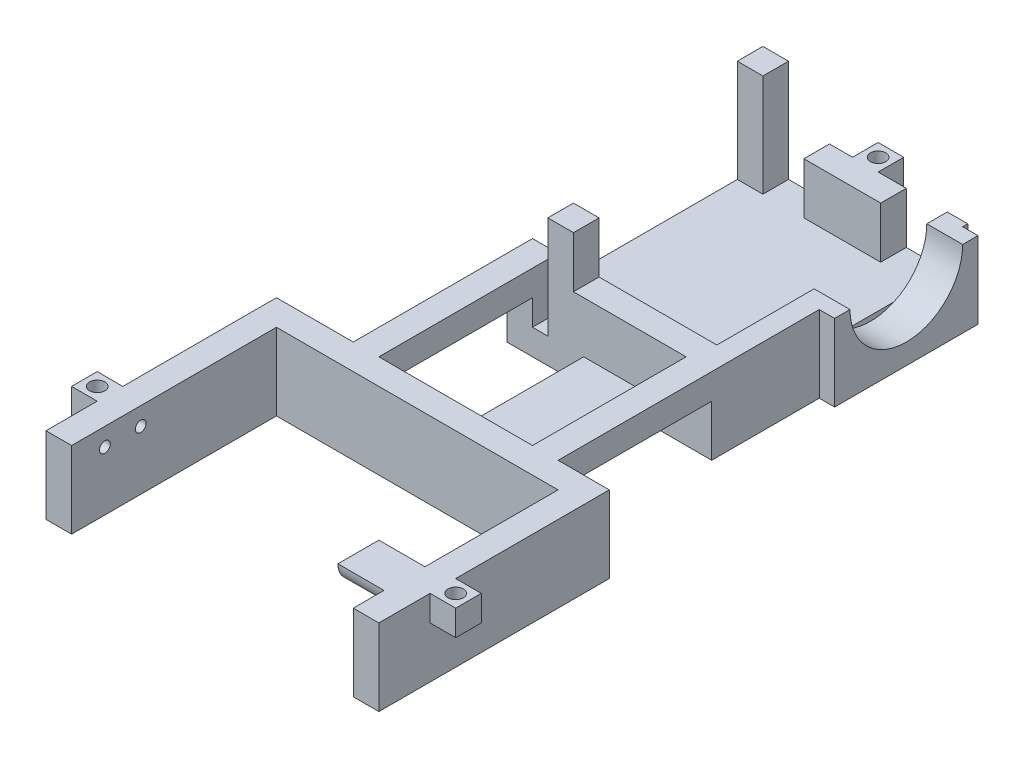
from build123d import *

# Parameters (mm, degrees)
SKETCH1_W            = 40
SKETCH1_H            = 50
BOSS_EXTRUDE1_DEPTH  = 5
SKETCH4_W            = 5
SKETCH4_H            = 5
BOSS_EXTRUDE4_DEPTH  = 20
SKETCH4_4_W          = 5
SKETCH4_4_H          = 5
SKETCH4_4_W_2        = 15
BOSS_EXTRUDE5_DEPTH  = 10
CUT_EXTRUDE2_DEPTH   = 4
BOSS_EXTRUDE7_START  = 3
BOSS_EXTRUDE7_DEPTH  = 3
SKETCH10_W           = 5
SKETCH10_H           = 5
BOSS_EXTRUDE9_DEPTH  = 5
SKETCH11_R           = 1.5
CUT_EXTRUDE3_DEPTH   = 5
SKETCH12_W           = 5
SKETCH12_H           = 5
SKETCH12_W_2         = 10
BOSS_EXTRUDE10_DEPTH = 30
SKETCH13_W           = 40
SKETCH13_H           = 15
BOSS_EXTRUDE11_DEPTH = 5
SKETCH14_W           = 5
SKETCH14_H           = 15
BOSS_EXTRUDE12_DEPTH = 10
SKETCH15_W           = 5
SKETCH15_H           = 15
BOSS_EXTRUDE13_DEPTH = 15
SKETCH16_W           = 5
SKETCH16_H           = 15
BOSS_EXTRUDE14_DEPTH = 40
BOSS_EXTRUDE15_DEPTH = 9
SKETCH18_W           = 5
SKETCH18_H           = 5
BOSS_EXTRUDE16_DEPTH = 5
SKETCH19_R           = 1.5
CUT_EXTRUDE4_DEPTH   = 5
SKETCH20_W           = 5
SKETCH20_H           = 5
BOSS_EXTRUDE17_DEPTH = 5
SKETCH21_R           = 1.5
CUT_EXTRUDE5_DEPTH   = 5
SKETCH24_R           = 1.05
CUT_EXTRUDE6_DEPTH   = 5


with BuildPart() as part:
    # Sketch1 → Boss-Extrude1 (new body)
    with BuildSketch(Plane(origin=(0, 0, 0), x_dir=(1, 0, 0), z_dir=(0, 1, 0))):
        Rectangle(SKETCH1_W, SKETCH1_H)
    extrude(amount=BOSS_EXTRUDE1_DEPTH)

    # Sketch4 → Boss-Extrude4 (add)
    with BuildSketch(Plane(origin=(0, 5, 0), x_dir=(1, 0, 0), z_dir=(0, 1, 0))):
        with Locations((-9.5, -22.5)):
            Rectangle(SKETCH4_W, SKETCH4_H)
        with Locations((-17.5, 22.5)):
            Rectangle(SKETCH4_W, SKETCH4_H)
    extrude(amount=BOSS_EXTRUDE4_DEPTH)

    # Sketch4<4> → Boss-Extrude5 (add)
    with BuildSketch(Plane(origin=(0, 5, 0), x_dir=(1, 0, 0), z_dir=(0, 1, 0))):
        Polygon((20, -25), (20, 25), (16, 25), (16, -20), (-7, -20), (-7, -25), align=None)
        with Locations((-17.5, -22.5)):
            Rectangle(SKETCH4_4_W, SKETCH4_4_H)
        with Locations((0.5, 22.5)):
            Rectangle(SKETCH4_4_W_2, SKETCH4_4_H)
    extrude(amount=BOSS_EXTRUDE5_DEPTH)

    # Sketch7 → Cut-Extrude2 (cut)
    with BuildSketch(Plane(origin=(20, 0, 0), x_dir=(0, 0, -1), z_dir=(1, 0, 0))):
        with BuildLine():
            Line((-1, 15), (21, 15))
            ThreePointArc((21, 15), (10, 4), (-1, 15))
        make_face()
    extrude(amount=-CUT_EXTRUDE2_DEPTH, mode=Mode.SUBTRACT)

    # Sketch8 → Boss-Extrude7 (add)
    with BuildSketch(Plane(origin=(20, 0, 0), x_dir=(0, 0, -1), z_dir=(1, 0, 0)).offset(BOSS_EXTRUDE7_START)):
        with BuildLine():
            Line((-1, 15), (-4, 15))
            Line((-4, 15), (-4, 0))
            Line((-4, 0), (24, 0))
            Line((24, 0), (24, 15))
            Line((24, 15), (21, 15))
            ThreePointArc((21, 15), (10, 4), (-1, 15))
        make_face()
    extrude(amount=-BOSS_EXTRUDE7_DEPTH)

    # Sketch10 → Boss-Extrude9 (add)
    with BuildSketch(Plane(origin=(0, 0, -25), x_dir=(-1, 0, 0), z_dir=(0, 0, -1))):
        with Locations((0, 12.5)):
            Rectangle(SKETCH10_W, SKETCH10_H)
    extrude(amount=BOSS_EXTRUDE9_DEPTH)

    # Sketch11 → Cut-Extrude3 (cut)
    with BuildSketch(Plane.XZ.offset(-10)):
        with Locations((0, -27.5)):
            Circle(SKETCH11_R)
    extrude(amount=-CUT_EXTRUDE3_DEPTH, mode=Mode.SUBTRACT)

    # Sketch12 → Boss-Extrude10 (add)
    with BuildSketch(Plane.XY.offset(25)):
        with Locations((-17.5, 12.5)):
            Rectangle(SKETCH12_W, SKETCH12_H)
        with Locations((17.5, 12.5)):
            Rectangle(SKETCH12_W, SKETCH12_H)
        with Locations((0, 2.5)):
            Rectangle(SKETCH12_W_2, SKETCH12_H)
    extrude(amount=BOSS_EXTRUDE10_DEPTH)

    # Sketch13 → Boss-Extrude11 (add)
    with BuildSketch(Plane.XY.offset(55)):
        with Locations((0, 7.5)):
            Rectangle(SKETCH13_W, SKETCH13_H)
    extrude(amount=BOSS_EXTRUDE11_DEPTH)

    # Sketch14 → Boss-Extrude12 (add)
    with BuildSketch(Plane(origin=(20, 0, 0), x_dir=(0, 0, -1), z_dir=(1, 0, 0))):
        with Locations((-57.5, 7.5)):
            Rectangle(SKETCH14_W, SKETCH14_H)
    extrude(amount=BOSS_EXTRUDE12_DEPTH)

    # Sketch15 → Boss-Extrude13 (add)
    with BuildSketch(Plane.ZY.offset(20)):
        with Locations((57.5, 7.5)):
            Rectangle(SKETCH15_W, SKETCH15_H)
    extrude(amount=BOSS_EXTRUDE13_DEPTH)

    # Sketch16 → Boss-Extrude14 (add)
    with BuildSketch(Plane.XY.offset(60)):
        with Locations((-32.5, 7.5)):
            Rectangle(SKETCH16_W, SKETCH16_H)
        with Locations((27.5, 7.5)):
            Rectangle(SKETCH16_W, SKETCH16_H)
    extrude(amount=BOSS_EXTRUDE14_DEPTH)

    # Sketch17 → Boss-Extrude15 (add)
    with BuildSketch(Plane.ZY.offset(-25)):
        with BuildLine():
            Line((86, 15), (94, 15))
            ThreePointArc((94, 15), (90, 11), (86, 15))
        make_face()
    extrude(amount=BOSS_EXTRUDE15_DEPTH)

    # Sketch18 → Boss-Extrude16 (add)
    with BuildSketch(Plane.ZY.offset(35)):
        with Locations((87.5, 12.5)):
            Rectangle(SKETCH18_W, SKETCH18_H)
    extrude(amount=BOSS_EXTRUDE16_DEPTH)

    # Sketch19 → Cut-Extrude4 (cut)
    with BuildSketch(Plane.XZ.offset(-10)):
        with Locations((-37.5, 87.5)):
            Circle(SKETCH19_R)
    extrude(amount=-CUT_EXTRUDE4_DEPTH, mode=Mode.SUBTRACT)

    # Sketch20 → Boss-Extrude17 (add)
    with BuildSketch(Plane(origin=(30, 0, 0), x_dir=(0, 0, -1), z_dir=(1, 0, 0))):
        with Locations((-87.5, 12.5)):
            Rectangle(SKETCH20_W, SKETCH20_H)
    extrude(amount=BOSS_EXTRUDE17_DEPTH)

    # Sketch21 → Cut-Extrude5 (cut)
    with BuildSketch(Plane.XZ.offset(-10)):
        with Locations((32.5, 87.5)):
            Circle(SKETCH21_R)
    extrude(amount=-CUT_EXTRUDE5_DEPTH, mode=Mode.SUBTRACT)

    # Sketch24 → Cut-Extrude6 (cut)
    with BuildSketch(Plane(origin=(-30, 0, 0), x_dir=(0, 0, -1), z_dir=(1, 0, 0))):
        with Locations((-93.5, 11.5)):
            Circle(SKETCH24_R)
        with Locations((-86.5, 11.5)):
            Circle(SKETCH24_R)
    extrude(amount=-CUT_EXTRUDE6_DEPTH, mode=Mode.SUBTRACT)


solid = part.part
